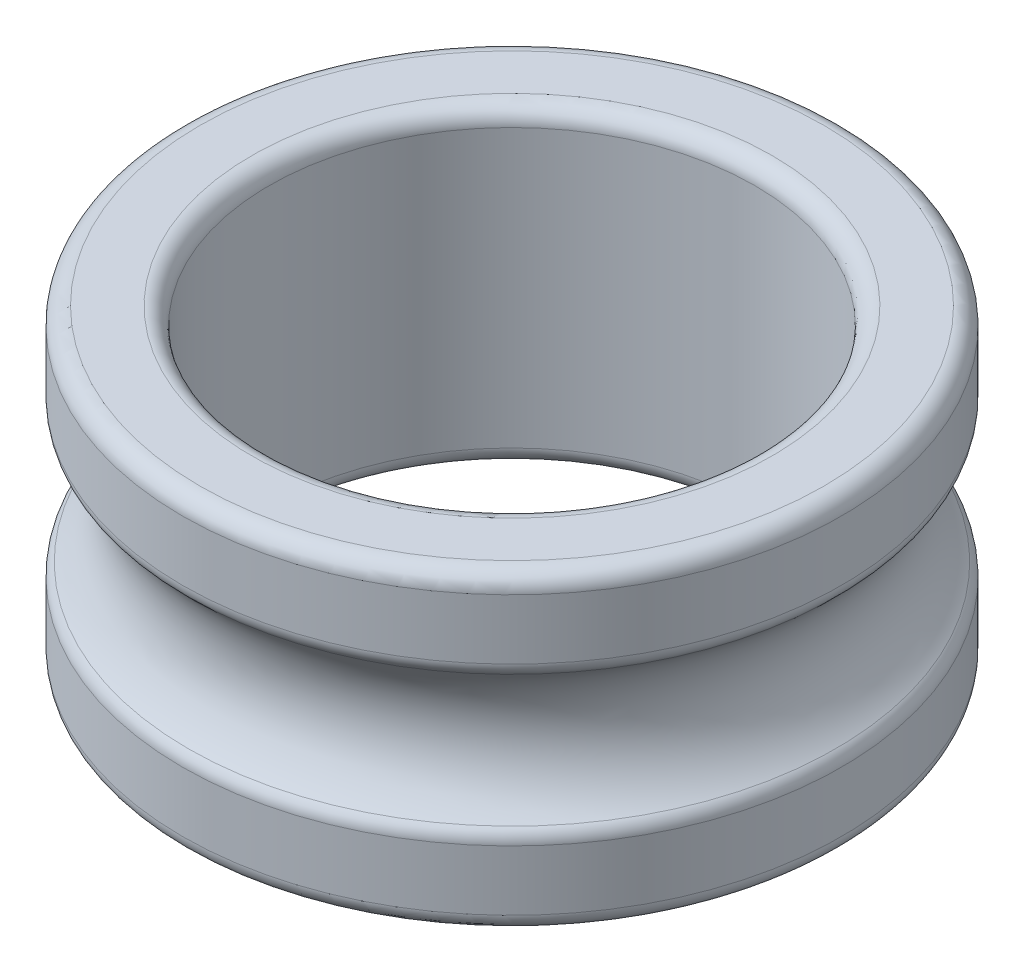
from build123d import *

# Parameters (mm, degrees)
SCALE1_SCALE = 0.266666667


with BuildPart() as part:
    # Sketch1 → Revolve1 (revolve)
    with BuildSketch(Plane(origin=(0, 0, 0), x_dir=(0, 0, -1), z_dir=(1, 0, 0))):
        with BuildLine():
            Line((14, 8), (14, -8))
            ThreePointArc((14, -8), (14.292893219, -8.707106781), (15, -9))
            Line((15, -9), (18, -9))
            ThreePointArc((18, -9), (18.707106781, -8.707106781), (19, -8))
            Line((19, -8), (19, -4.538997687))
            ThreePointArc((19, -4.538997687), (18.911360803, -4.127389271), (18.661157025, -3.788750135))
            ThreePointArc((18.661157025, -3.788750135), (16.95, 0), (18.661157025, 3.788750135))
            ThreePointArc((18.661157025, 3.788750135), (18.911360803, 4.127389271), (19, 4.538997687))
            Line((19, 4.538997687), (19, 8))
            ThreePointArc((19, 8), (18.707106781, 8.707106781), (18, 9))
            Line((18, 9), (15, 9))
            ThreePointArc((15, 9), (14.292893219, 8.707106781), (14, 8))
        make_face()
    revolve(axis=Axis((0, -9.810774163, 0), (0, 1, 0)))


with BuildPart() as part_1:
    # Scale1: scaled about (0, 0, 0)
    add(part.part.scale(SCALE1_SCALE))


solid = part_1.part
